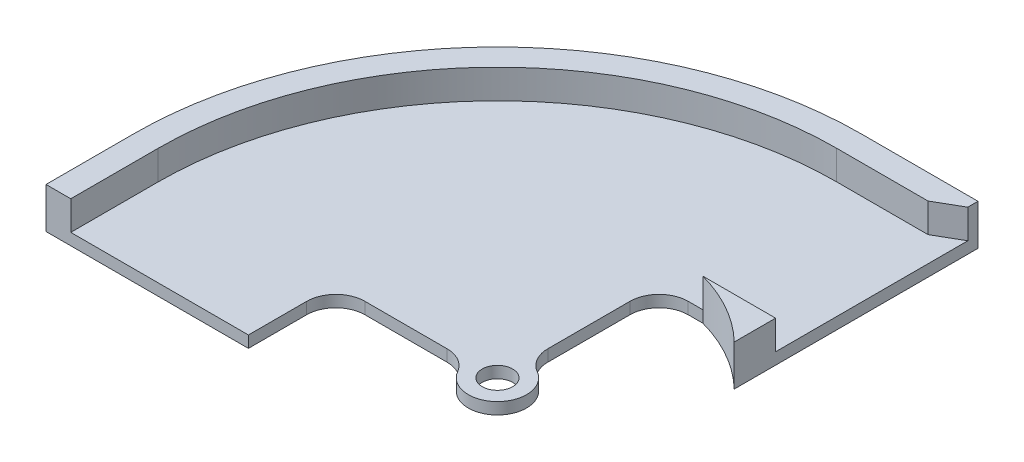
from build123d import *

# Parameters (mm, degrees)
SKETCH1_W           = 125
SKETCH1_H           = 125
BOSS_EXTRUDE1_DEPTH = 4
SKETCH7_W           = 40
SKETCH7_H           = 69.5
BOSS_EXTRUDE4_DEPTH = 4
SKETCH8_W           = 69.5
SKETCH8_H           = 30
BOSS_EXTRUDE5_DEPTH = 4
BOSS_EXTRUDE2_DEPTH = 10
SKETCH3_R           = 10
BOSS_EXTRUDE3_DEPTH = 4
SKETCH4_R           = 5.25
CUT_EXTRUDE1_DEPTH  = 4
FILLET1_R           = 125
CHAMFER1_SIZE       = 5
CHAMFER1_SIZE2      = 8.660254038
BOSS_EXTRUDE6_DEPTH = 14
FILLET2_R           = 10


with BuildPart() as part:
    # Sketch1 → Boss-Extrude1 (new body)
    with BuildSketch(Plane(origin=(0, 0, 0), x_dir=(1, 0, 0), z_dir=(0, 1, 0))):
        Rectangle(SKETCH1_W, SKETCH1_H)
    extrude(amount=BOSS_EXTRUDE1_DEPTH)

    # Sketch7 → Boss-Extrude4 (add)
    with BuildSketch(Plane(origin=(0, 0, 0), x_dir=(1, 0, 0), z_dir=(0, 1, 0))):
        with Locations((82.5, 27.75)):
            Rectangle(SKETCH7_W, SKETCH7_H)
    extrude(amount=BOSS_EXTRUDE4_DEPTH)

    # Sketch8 → Boss-Extrude5 (add)
    with BuildSketch(Plane(origin=(0, 0, 0), x_dir=(1, 0, 0), z_dir=(0, 1, 0))):
        with Locations((-27.75, -77.5)):
            Rectangle(SKETCH8_W, SKETCH8_H)
    extrude(amount=BOSS_EXTRUDE5_DEPTH)

    # Sketch2 → Boss-Extrude2 (add)
    with BuildSketch(Plane(origin=(0, 4, 0), x_dir=(1, 0, 0), z_dir=(0, 1, 0))):
        with BuildLine():
            Line((-62.5, -92.5), (-62.5, 62.5))
            Line((-62.5, 62.5), (102.5, 62.5))
            Line((102.5, 62.5), (102.5, 54))
            Line((102.5, 54), (62.5, 54))
            ThreePointArc((62.5, 54), (-19.877940008, 19.877940008), (-54, -62.5))
            Line((-54, -62.5), (-54, -92.5))
            Line((-54, -92.5), (-62.5, -92.5))
        make_face()
    extrude(amount=BOSS_EXTRUDE2_DEPTH)

    # Sketch3 → Boss-Extrude3 (add)
    with BuildSketch(Plane(origin=(0, 4, 0), x_dir=(1, 0, 0), z_dir=(0, 1, 0))):
        with Locations((62.5, -62.5)):
            Circle(SKETCH3_R)
    extrude(amount=-BOSS_EXTRUDE3_DEPTH)

    # Sketch4 → Cut-Extrude1 (cut)
    with BuildSketch(Plane(origin=(0, 4, 0), x_dir=(1, 0, 0), z_dir=(0, 1, 0))):
        with Locations(Location((62.5, -62.5, 0), (0, 0, 270))):
            Circle(SKETCH4_R)
    extrude(amount=-CUT_EXTRUDE1_DEPTH, mode=Mode.SUBTRACT)

    # Fillet1
    fillet1_edges = [part.edges().sort_by_distance(p)[0] for p in [
        (-62.5, 7, -62.5),
    ]]
    fillet(fillet1_edges, radius=FILLET1_R)

    # Chamfer1
    chamfer1_edges = [part.edges().sort_by_distance(p)[0] for p in [
        (102.5, 9, -54),
    ]]
    chamfer1_side = [part.faces().sort_by_distance(p)[0] for p in [
        (102.5, 3.639118457, -34.891873278),
    ]]
    chamfer(chamfer1_edges, length=CHAMFER1_SIZE, length2=CHAMFER1_SIZE2, reference=chamfer1_side[0])

    # Sketch9 → Boss-Extrude6 (add)
    with BuildSketch(Plane(origin=(0, 0, 0), x_dir=(1, 0, 0), z_dir=(0, 1, 0))):
        with BuildLine():
            Line((102.5, -7), (102.5, -21.193220895))
            ThreePointArc((102.5, -21.193220895), (90.917033755, -12.512779707), (77.533296378, -7))
            Line((77.533296378, -7), (102.5, -7))
        make_face()
    extrude(amount=BOSS_EXTRUDE6_DEPTH)

    # Fillet2
    fillet2_edges = [part.edges().sort_by_distance(p)[0] for p in [
        (62.5, 2, 7),
        (7, 2, 62.5),
        (62.5, 2, 52.5),
        (52.5, 2, 62.5),
    ]]
    fillet(fillet2_edges, radius=FILLET2_R)


solid = part.part
